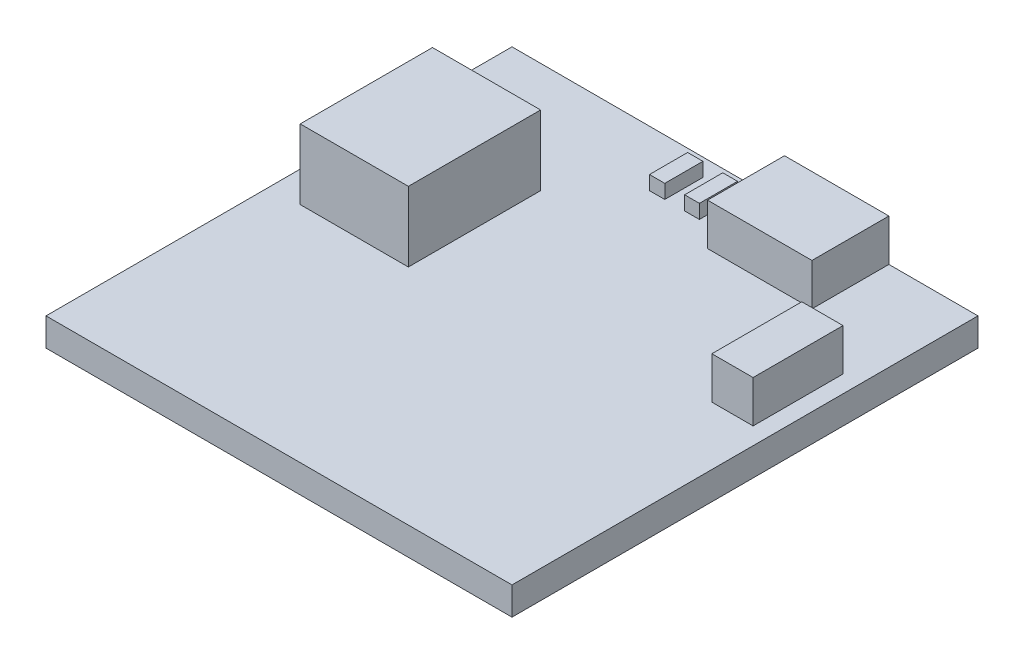
from build123d import *

# Parameters (mm, degrees)
SKETCH1_W           = 33.3375
SKETCH1_H           = 33.3375
BOSS_EXTRUDE1_DEPTH = 2
SKETCH2_W           = 7.736083449
SKETCH2_H           = 9.461345449
BOSS_EXTRUDE2_DEPTH = 5
SKETCH4_W           = 2.947854253
SKETCH4_H           = 6.435986303
BOSS_EXTRUDE3_DEPTH = 3
SKETCH5_W           = 1.093391386
SKETCH5_H           = 2.729545453
SKETCH5_W_2         = 1.056992946
BOSS_EXTRUDE4_DEPTH = 1
SKETCH6_W           = 7.46808346
SKETCH6_H           = 5.505379369
BOSS_EXTRUDE5_DEPTH = 3


with BuildPart() as part:
    # Sketch1 → Boss-Extrude1 (new body)
    with BuildSketch(Plane(origin=(0, 0, 0), x_dir=(1, 0, 0), z_dir=(0, 1, 0))):
        with Locations((16.66875, 16.66875)):
            Rectangle(SKETCH1_W, SKETCH1_H)
    extrude(amount=BOSS_EXTRUDE1_DEPTH)

    # Sketch2 → Boss-Extrude2 (add)
    with BuildSketch(Plane(origin=(0, 2, 0), x_dir=(1, 0, 0), z_dir=(0, 1, 0))):
        with Locations((6.067363874, 20.718036439)):
            Rectangle(SKETCH2_W, SKETCH2_H)
    extrude(amount=BOSS_EXTRUDE2_DEPTH)

    # Sketch4 → Boss-Extrude3 (add)
    with BuildSketch(Plane(origin=(0, 2, 0), x_dir=(1, 0, 0), z_dir=(0, 1, 0))):
        with Locations((30.638118597, 21.689837472)):
            Rectangle(SKETCH4_W, SKETCH4_H)
    extrude(amount=BOSS_EXTRUDE3_DEPTH)

    # Sketch5 → Boss-Extrude4 (add)
    with BuildSketch(Plane(origin=(0, 2, 0), x_dir=(1, 0, 0), z_dir=(0, 1, 0))):
        with Locations((14.375478356, 30.708236471)):
            Rectangle(SKETCH5_W, SKETCH5_H)
        with Locations((16.871379042, 30.708236471)):
            Rectangle(SKETCH5_W_2, SKETCH5_H)
    extrude(amount=BOSS_EXTRUDE4_DEPTH)

    # Sketch6 → Boss-Extrude5 (add)
    with BuildSketch(Plane(origin=(0, 2, 0), x_dir=(1, 0, 0), z_dir=(0, 1, 0))):
        with Locations((23.229569505, 30.584810316)):
            Rectangle(SKETCH6_W, SKETCH6_H)
    extrude(amount=BOSS_EXTRUDE5_DEPTH)


solid = part.part
